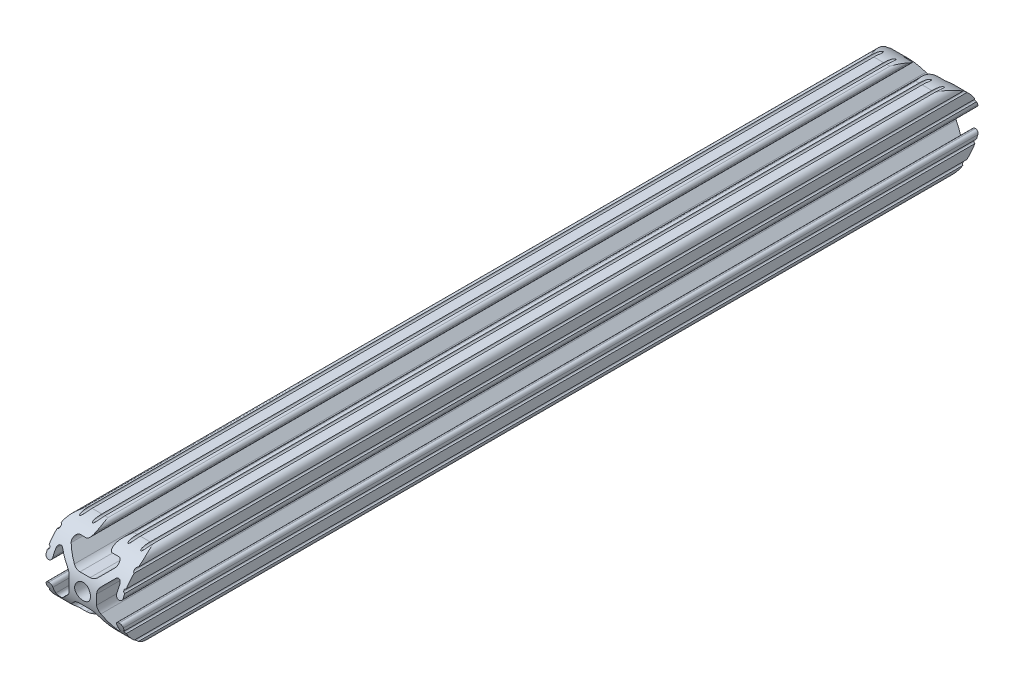
from build123d import *
from build123d.topology import SkipClean

# Parameters (mm, degrees)
SKETCH1_R               = 2.6035
BOSS_EXTRUDE1_DEPTH     = 141.2875
CUT_EXTRUDE1_DEPTH      = 145.113176553
CUT_EXTRUDE1_DEPTH_BACK = 145.113176553


with BuildPart() as part:
    # Sketch1 → Boss-Extrude1 (new, symmetric)
    with BuildSketch(Plane.XY):
        with BuildLine():
            Line((-7.179650497, -8.645192506), (-3.952270251, -5.423690499))
            ThreePointArc((-3.952270251, -5.423690499), (-2.922936451, -4.736929036), (-1.709253557, -4.4958))
            Line((-1.709253557, -4.4958), (1.709253557, -4.4958))
            ThreePointArc((1.709253557, -4.4958), (2.922936451, -4.736929036), (3.952270251, -5.423690499))
            Line((3.952270251, -5.423690499), (7.179650497, -8.645192506))
            ThreePointArc((7.179650497, -8.645192506), (7.41473083, -9.822813117), (6.416408329, -10.4902))
            Line((6.416408329, -10.4902), (4.287512407, -10.4902))
            ThreePointArc((4.287512407, -10.4902), (3.54574862, -10.79744862), (3.2385, -11.539212407))
            Line((3.2385, -11.539212407), (3.2385, -11.650987593))
            ThreePointArc((3.2385, -11.650987593), (3.54574862, -12.39275138), (4.287512407, -12.7))
            Line((4.287512407, -12.7), (5.317126718, -12.7))
            ThreePointArc((5.317126718, -12.7), (5.825126718, -12.192), (6.333126718, -12.7))
            Line((6.333126718, -12.7), (9.550443118, -12.7))
            ThreePointArc((9.550443118, -12.7), (10.058366869, -12.192000006), (10.566443095, -12.699847501))
            ThreePointArc((10.566443095, -12.699847501), (12.082537762, -12.08250727), (12.699846982, -10.566399977))
            ThreePointArc((12.699846982, -10.566399977), (12.192000006, -10.058323491), (12.7, -9.5504))
            Line((12.7, -9.5504), (12.7, -6.3330836))
            ThreePointArc((12.7, -6.3330836), (12.192, -5.8250836), (12.7, -5.3170836))
            Line((12.7, -5.3170836), (12.7, -4.287469289))
            ThreePointArc((12.7, -4.287469289), (12.39275138, -3.545705502), (11.650987593, -3.238456882))
            Line((11.650987593, -3.238456882), (11.539212407, -3.238456882))
            ThreePointArc((11.539212407, -3.238456882), (10.79744862, -3.545705502), (10.4902, -4.287469289))
            Line((10.4902, -4.287469289), (10.4902, -6.402089023))
            ThreePointArc((10.4902, -6.402089023), (9.856505071, -7.351067942), (8.737131347, -7.129408934))
            Line((8.737131347, -7.129408934), (5.441005833, -3.840816462))
            ThreePointArc((5.441005833, -3.840816462), (4.750877967, -2.809883091), (4.5085, -1.593185507))
            Line((4.5085, -1.593185507), (4.5085, 1.593185507))
            ThreePointArc((4.5085, 1.593185507), (4.750877967, 2.809883091), (5.441005833, 3.840816462))
            Line((5.441005833, 3.840816462), (8.737131347, 7.129408934))
            ThreePointArc((8.737131347, 7.129408934), (9.856505071, 7.351067942), (10.4902, 6.402089023))
            Line((10.4902, 6.402089023), (10.4902, 4.287469289))
            ThreePointArc((10.4902, 4.287469289), (10.79744862, 3.545705502), (11.539212407, 3.238456882))
            Line((11.539212407, 3.238456882), (11.650987593, 3.238456882))
            ThreePointArc((11.650987593, 3.238456882), (12.39275138, 3.545705502), (12.7, 4.287469289))
            Line((12.7, 4.287469289), (12.7, 5.3170836))
            ThreePointArc((12.7, 5.3170836), (12.192, 5.8250836), (12.7, 6.3330836))
            Line((12.7, 6.3330836), (12.7, 9.5504))
            ThreePointArc((12.7, 9.5504), (12.192000006, 10.058323491), (12.699846982, 10.566399977))
            ThreePointArc((12.699846982, 10.566399977), (12.082537762, 12.08250727), (10.566443095, 12.699847501))
            ThreePointArc((10.566443095, 12.699847501), (10.058366869, 12.192000006), (9.550443118, 12.7))
            Line((9.550443118, 12.7), (6.333126718, 12.7))
            ThreePointArc((6.333126718, 12.7), (5.825126718, 12.192), (5.317126718, 12.7))
            Line((5.317126718, 12.7), (4.287512407, 12.7))
            ThreePointArc((4.287512407, 12.7), (3.54574862, 12.39275138), (3.2385, 11.650987593))
            Line((3.2385, 11.650987593), (3.2385, 11.539212407))
            ThreePointArc((3.2385, 11.539212407), (3.54574862, 10.79744862), (4.287512407, 10.4902))
            Line((4.287512407, 10.4902), (6.476788598, 10.4902))
            ThreePointArc((6.476788598, 10.4902), (7.432222385, 9.85140422), (7.207036008, 8.724370562))
            Line((7.207036008, 8.724370562), (3.898272566, 5.423169045))
            ThreePointArc((3.898272566, 5.423169045), (2.869120213, 4.736787962), (1.655778399, 4.4958))
            Line((1.655778399, 4.4958), (-1.655778399, 4.4958))
            ThreePointArc((-1.655778399, 4.4958), (-2.869120213, 4.736787962), (-3.898272566, 5.423169045))
            Line((-3.898272566, 5.423169045), (-7.207036008, 8.724370562))
            ThreePointArc((-7.207036008, 8.724370562), (-7.432222385, 9.85140422), (-6.476788598, 10.4902))
            Line((-6.476788598, 10.4902), (-4.287512407, 10.4902))
            ThreePointArc((-4.287512407, 10.4902), (-3.54574862, 10.79744862), (-3.2385, 11.539212407))
            Line((-3.2385, 11.539212407), (-3.2385, 11.650987593))
            ThreePointArc((-3.2385, 11.650987593), (-3.54574862, 12.39275138), (-4.287512407, 12.7))
            Line((-4.287512407, 12.7), (-5.317126718, 12.7))
            ThreePointArc((-5.317126718, 12.7), (-5.825126718, 12.192), (-6.333126718, 12.7))
            Line((-6.333126718, 12.7), (-9.550443118, 12.7))
            ThreePointArc((-9.550443118, 12.7), (-10.058366869, 12.192000006), (-10.566443095, 12.699847501))
            ThreePointArc((-10.566443095, 12.699847501), (-12.082537762, 12.08250727), (-12.699846982, 10.566399977))
            ThreePointArc((-12.699846982, 10.566399977), (-12.192000006, 10.058323491), (-12.7, 9.5504))
            Line((-12.7, 9.5504), (-12.7, 6.3330836))
            ThreePointArc((-12.7, 6.3330836), (-12.192, 5.8250836), (-12.7, 5.3170836))
            Line((-12.7, 5.3170836), (-12.7, 4.287469289))
            ThreePointArc((-12.7, 4.287469289), (-12.39275138, 3.545705502), (-11.650987593, 3.238456882))
            Line((-11.650987593, 3.238456882), (-11.539212407, 3.238456882))
            ThreePointArc((-11.539212407, 3.238456882), (-10.79744862, 3.545705502), (-10.4902, 4.287469289))
            Line((-10.4902, 4.287469289), (-10.4902, 6.402089023))
            ThreePointArc((-10.4902, 6.402089023), (-9.856505071, 7.351067942), (-8.737131347, 7.129408934))
            Line((-8.737131347, 7.129408934), (-5.441005833, 3.840816462))
            ThreePointArc((-5.441005833, 3.840816462), (-4.750877967, 2.809883091), (-4.5085, 1.593185507))
            Line((-4.5085, 1.593185507), (-4.5085, -1.593185507))
            ThreePointArc((-4.5085, -1.593185507), (-4.750877967, -2.809883091), (-5.441005833, -3.840816462))
            Line((-5.441005833, -3.840816462), (-8.737131347, -7.129408934))
            ThreePointArc((-8.737131347, -7.129408934), (-9.856505071, -7.351067942), (-10.4902, -6.402089023))
            Line((-10.4902, -6.402089023), (-10.4902, -4.287469289))
            ThreePointArc((-10.4902, -4.287469289), (-10.79744862, -3.545705502), (-11.539212407, -3.238456882))
            Line((-11.539212407, -3.238456882), (-11.650987593, -3.238456882))
            ThreePointArc((-11.650987593, -3.238456882), (-12.39275138, -3.545705502), (-12.7, -4.287469289))
            Line((-12.7, -4.287469289), (-12.7, -5.3170836))
            ThreePointArc((-12.7, -5.3170836), (-12.192, -5.8250836), (-12.7, -6.3330836))
            Line((-12.7, -6.3330836), (-12.7, -9.5504))
            ThreePointArc((-12.7, -9.5504), (-12.192000006, -10.058323491), (-12.699846982, -10.566399977))
            ThreePointArc((-12.699846982, -10.566399977), (-12.082537762, -12.08250727), (-10.566443095, -12.699847501))
            ThreePointArc((-10.566443095, -12.699847501), (-10.058366869, -12.192000006), (-9.550443118, -12.7))
            Line((-9.550443118, -12.7), (-6.333126718, -12.7))
            ThreePointArc((-6.333126718, -12.7), (-5.825126718, -12.192), (-5.317126718, -12.7))
            Line((-5.317126718, -12.7), (-4.287512407, -12.7))
            ThreePointArc((-4.287512407, -12.7), (-3.54574862, -12.39275138), (-3.2385, -11.650987593))
            Line((-3.2385, -11.650987593), (-3.2385, -11.539212407))
            ThreePointArc((-3.2385, -11.539212407), (-3.54574862, -10.79744862), (-4.287512407, -10.4902))
            Line((-4.287512407, -10.4902), (-6.416408329, -10.4902))
            ThreePointArc((-6.416408329, -10.4902), (-7.41473083, -9.822813117), (-7.179650497, -8.645192506))
        make_face()
        Circle(SKETCH1_R, mode=Mode.SUBTRACT)
    extrude(amount=BOSS_EXTRUDE1_DEPTH, both=True)

    # Sketch3 → Cut-Extrude1 (cut, two sides: drawn at the far end of the back side and taken through both)
    with SkipClean():  # the faces are left unmerged after this step: merging them gives an invalid solid
        with BuildSketch(Plane(origin=(12.7, 0, 0), x_dir=(0, 0, -1), z_dir=(1, 0, 0)).offset(-CUT_EXTRUDE1_DEPTH_BACK)):
            with BuildLine():
                Line((-141.2875, -12.7), (-128.5875, -12.7))
                ThreePointArc((-128.5875, -12.7), (-137.567756121, -8.980256121), (-141.2875, 0))
                Line((-141.2875, 0), (-141.2875, -12.7))
            make_face()
            with BuildLine():
                Line((-141.2875, 6.3330836), (-139.595771986, 6.3330836))
                ThreePointArc((-139.595771986, 6.3330836), (-138.409945015, 8.050439363), (-136.958871443, 9.5504))
                Line((-136.958871443, 9.5504), (-141.2875, 9.5504))
                Line((-141.2875, 9.5504), (-141.2875, 6.3330836))
            make_face()
            with BuildLine():
                ThreePointArc((-136.958871443, 9.5504), (-133.059631483, 11.8865487), (-128.5875, 12.7))
                Line((-128.5875, 12.7), (-141.2875, 12.7))
                Line((-141.2875, 12.7), (-141.2875, 9.5504))
                Line((-141.2875, 9.5504), (-136.958871443, 9.5504))
            make_face()
            with BuildLine():
                Line((-141.2875, 6.3330836), (-141.2875, 0))
                ThreePointArc((-141.2875, 0), (-140.857281054, 3.277571188), (-139.595771986, 6.3330836))
                Line((-139.595771986, 6.3330836), (-141.2875, 6.3330836))
            make_face()
            with BuildLine():
                ThreePointArc((-100.0125, 0), (-103.1875, 3.175), (-106.3625, 0))
                Line((-106.3625, 0), (-100.0125, 0))
            make_face()
            with BuildLine():
                Line((-100.0125, 0), (-106.3625, 0))
                ThreePointArc((-106.3625, 0), (-103.1875, -3.175), (-100.0125, 0))
            make_face()
            with BuildLine():
                ThreePointArc((-131.7625, 0), (-128.5875, -3.175), (-125.4125, 0))
                Line((-125.4125, 0), (-131.7625, 0))
            make_face()
            with BuildLine():
                Line((-131.7625, 0), (-125.4125, 0))
                ThreePointArc((-125.4125, 0), (-128.5875, 3.175), (-131.7625, 0))
            make_face()
            with BuildLine():
                Line((141.2875, 12.7), (128.587500011, 12.7))
                ThreePointArc((128.587500011, 12.7), (133.059631488, 11.886548698), (136.958871443, 9.5504))
                Line((136.958871443, 9.5504), (141.2875, 9.5504))
                Line((141.2875, 9.5504), (141.2875, 12.7))
            make_face()
            with BuildLine():
                ThreePointArc((136.958871443, 9.5504), (138.409945015, 8.050439363), (139.595771986, 6.3330836))
                Line((139.595771986, 6.3330836), (141.2875, 6.3330836))
                Line((141.2875, 6.3330836), (141.2875, 9.5504))
                Line((141.2875, 9.5504), (136.958871443, 9.5504))
            make_face()
            with BuildLine():
                Line((141.2875, 6.3330836), (139.595771986, 6.3330836))
                ThreePointArc((139.595771986, 6.3330836), (140.857281054, 3.277571188), (141.2875, 0))
                Line((141.2875, 0), (141.2875, 6.3330836))
            make_face()
            with BuildLine():
                ThreePointArc((141.2875, 0), (137.567756128, -8.980256114), (128.587500019, -12.7))
                Line((128.587500019, -12.7), (141.2875, -12.7))
                Line((141.2875, -12.7), (141.2875, 0))
            make_face()
        extrude(amount=CUT_EXTRUDE1_DEPTH + CUT_EXTRUDE1_DEPTH_BACK, mode=Mode.SUBTRACT)


solid = part.part
